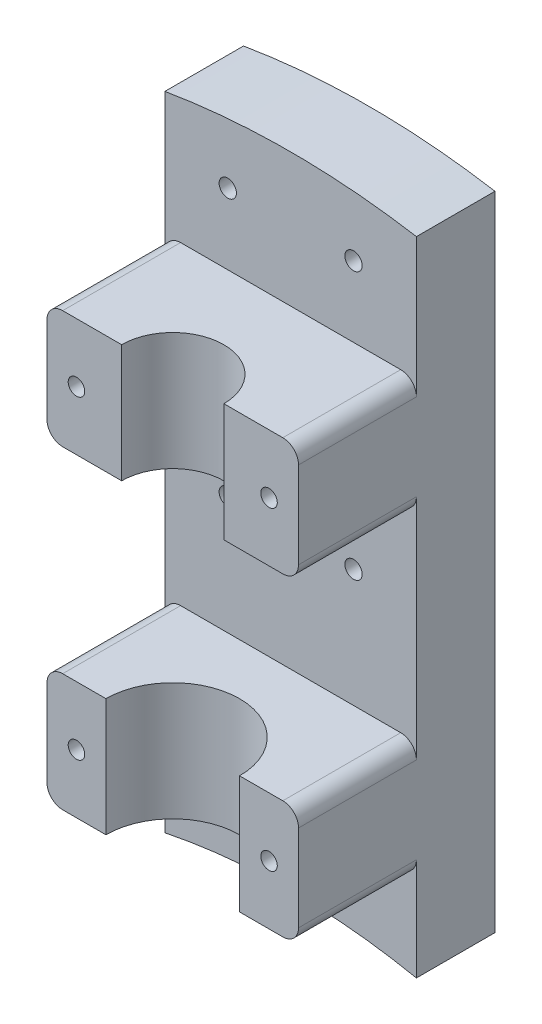
from build123d import *

# Parameters (mm, degrees)
SKETCH1_R               = 1.1
BOSS_EXTRUDE7_DEPTH     = 10
CUT_EXTRUDE4_DEPTH      = 74.565999455
CUT_EXTRUDE4_DEPTH_BACK = 74.565999455
SKETCH1_9_R             = 1.1
SKETCH6_W               = 32
SKETCH6_H               = 15
BOSS_EXTRUDE8_DEPTH     = 30
CUT_EXTRUDE5_DEPTH      = 16
CUT_EXTRUDE6_DEPTH      = 22
SKETCH10_R              = 1.05
CUT_EXTRUDE7_DEPTH      = 10
FILLET1_R               = 2


with BuildPart() as part:
    # Sketch1 → Boss-Extrude7 (new body)
    with BuildSketch(Plane.XY):
        with BuildLine():
            Line((-2.62989834, -18.895475724), (-2.62989834, 62.787818526))
            ThreePointArc((-2.62989834, 62.787818526), (-18.62989834, 64.130541996), (-34.62989834, 62.787818526))
            Line((-34.62989834, 62.787818526), (-34.62989834, -18.895475724))
            ThreePointArc((-34.62989834, -18.895475724), (-18.62989834, -17.279147493), (-2.62989834, -18.895475724))
        make_face()
        with Locations((-26.62989834, -9.279147493)):
            Circle(SKETCH1_R, mode=Mode.SUBTRACT)
        with Locations((-10.62989834, -9.279147493)):
            Circle(SKETCH1_R, mode=Mode.SUBTRACT)
    extrude(amount=BOSS_EXTRUDE7_DEPTH)

    # Sketch1<9> → Cut-Extrude4 (cut, two sides: drawn at the far end of the back side and taken through both)
    with BuildSketch(Plane.XY.offset(-CUT_EXTRUDE4_DEPTH_BACK)):
        with Locations((-10.62989834, 56.130541996)):
            Circle(SKETCH1_9_R)
        with Locations((-26.62989834, 56.130541996)):
            Circle(SKETCH1_9_R)
        with Locations((-10.62989834, 22.130541996)):
            Circle(SKETCH1_9_R)
        with Locations((-26.62989834, 22.130541996)):
            Circle(SKETCH1_9_R)
    extrude(amount=CUT_EXTRUDE4_DEPTH + CUT_EXTRUDE4_DEPTH_BACK, mode=Mode.SUBTRACT)

    # Sketch6 → Boss-Extrude8 (add)
    with BuildSketch(Plane.XY.offset(10)):
        with Locations((-18.62989834, -0.369458004)):
            Rectangle(SKETCH6_W, SKETCH6_H)
        with Locations((-18.62989834, 39.630541996)):
            Rectangle(SKETCH6_W, SKETCH6_H)
    extrude(amount=BOSS_EXTRUDE8_DEPTH)

    # Sketch7 → Cut-Extrude5 (cut)
    with BuildSketch(Plane(origin=(0, 47.130541996, 0), x_dir=(1, 0, 0), z_dir=(0, 1, 0))):
        with BuildLine():
            Line((-2.62989834, -40), (-2.62989834, -25))
            Line((-2.62989834, -25), (-12.12989834, -25))
            ThreePointArc((-12.12989834, -25), (-18.62989834, -18.5), (-25.12989834, -25))
            Line((-25.12989834, -25), (-34.62989834, -25))
            Line((-34.62989834, -25), (-34.62989834, -40))
            Line((-34.62989834, -40), (-2.62989834, -40))
        make_face()
    extrude(amount=-CUT_EXTRUDE5_DEPTH, mode=Mode.SUBTRACT)

    # Sketch8 → Cut-Extrude6 (cut)
    with BuildSketch(Plane(origin=(0, 7.130541996, 0), x_dir=(1, 0, 0), z_dir=(0, 1, 0))):
        with BuildLine():
            Line((-2.62989834, -25), (-10.12989834, -25))
            ThreePointArc((-10.12989834, -25), (-18.62989834, -16.5), (-27.12989834, -25))
            Line((-27.12989834, -25), (-34.62989834, -25))
            Line((-34.62989834, -25), (-34.62989834, -40))
            Line((-34.62989834, -40), (-2.62989834, -40))
            Line((-2.62989834, -40), (-2.62989834, -25))
        make_face()
    extrude(amount=-CUT_EXTRUDE6_DEPTH, mode=Mode.SUBTRACT)

    # Sketch10 → Cut-Extrude7 (cut)
    with BuildSketch(Plane.XY.offset(25)):
        with Locations((-30.87989834, -0.369458004)):
            Circle(SKETCH10_R)
        with Locations((-30.87989834, 39.630541996)):
            Circle(SKETCH10_R)
        with Locations((-6.37989834, -0.369458004)):
            Circle(SKETCH10_R)
        with Locations((-6.37989834, 39.630541996)):
            Circle(SKETCH10_R)
    extrude(amount=-CUT_EXTRUDE7_DEPTH, mode=Mode.SUBTRACT)

    # Fillet1
    fillet1_edges = [part.edges().sort_by_distance(p)[0] for p in [
        (-34.62989834, 7.130541996, 17.5),
        (-2.62989834, 7.130541996, 17.5),
        (-34.62989834, 47.130541996, 17.5),
        (-2.62989834, 47.130541996, 17.5),
        (-34.62989834, 32.130541996, 17.5),
        (-2.62989834, 32.130541996, 17.5),
        (-2.62989834, -7.869458004, 17.5),
        (-34.62989834, -7.869458004, 17.5),
    ]]
    fillet(fillet1_edges, radius=FILLET1_R)


solid = part.part
